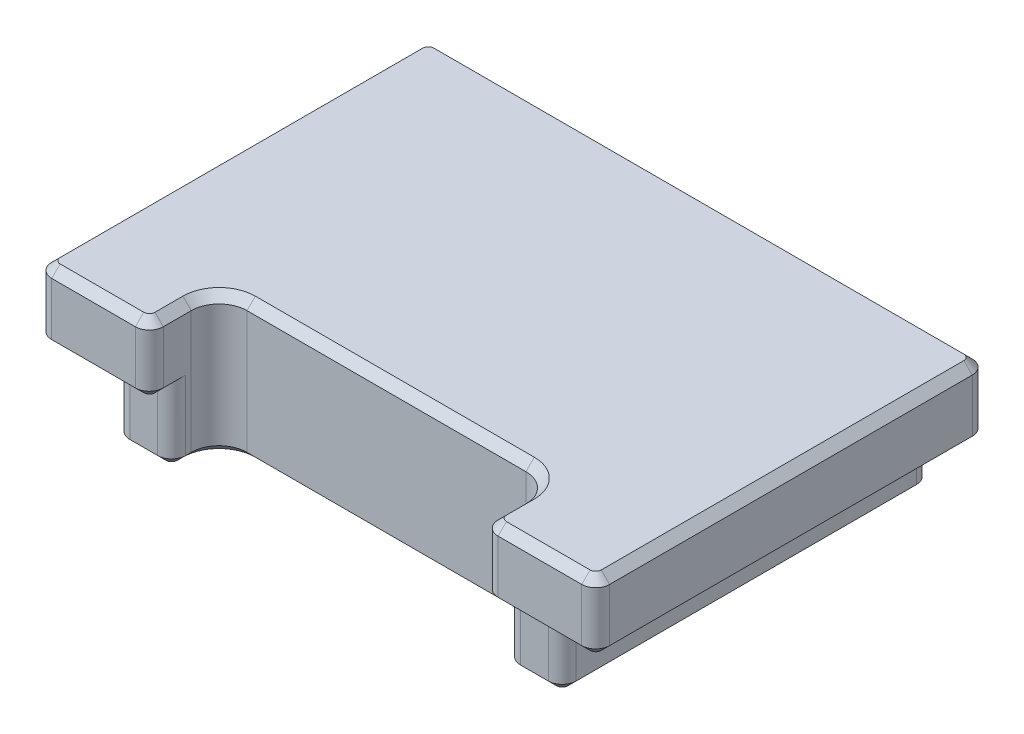
from build123d import *

# Parameters (mm, degrees)
SKETCH1_W           = 40
SKETCH1_H           = 28
BOSS_EXTRUDE1_DEPTH = 10
SKETCH2_W           = 40
SKETCH2_H           = 1.6
CUT_EXTRUDE1_DEPTH  = 5
SKETCH3_W           = 24
SKETCH3_H           = 10
CUT_EXTRUDE2_DEPTH  = 27.381811917
SKETCH4_W           = 4
SKETCH4_H           = 26.4
CUT_EXTRUDE3_DEPTH  = 5
FILLET1_R           = 2
FILLET2_R           = 1
CHAMFER2_SIZE       = 0.6


with BuildPart() as part:
    # Sketch1 → Boss-Extrude1 (new body)
    with BuildSketch(Plane(origin=(0, 0, 0), x_dir=(1, 0, 0), z_dir=(0, 1, 0))):
        Rectangle(SKETCH1_W, SKETCH1_H)
    extrude(amount=BOSS_EXTRUDE1_DEPTH)

    # Sketch2 → Cut-Extrude1 (cut)
    with BuildSketch(Plane.XZ):
        with Locations((0, 13.2)):
            Rectangle(SKETCH2_W, SKETCH2_H)
    extrude(amount=-CUT_EXTRUDE1_DEPTH, mode=Mode.SUBTRACT)

    # Sketch3 → Cut-Extrude2 (cut, through all)
    with BuildSketch(Plane(origin=(0, 10, 0), x_dir=(1, 0, 0), z_dir=(0, 1, 0))):
        with Locations((0, -14)):
            Rectangle(SKETCH3_W, SKETCH3_H)
    extrude(amount=-CUT_EXTRUDE2_DEPTH, mode=Mode.SUBTRACT)

    # Sketch4 → Cut-Extrude3 (cut)
    with BuildSketch(Plane.XZ):
        with Locations((-18, -0.8)):
            Rectangle(SKETCH4_W, SKETCH4_H)
        with Locations((18, -0.8)):
            Rectangle(SKETCH4_W, SKETCH4_H)
    extrude(amount=-CUT_EXTRUDE3_DEPTH, mode=Mode.SUBTRACT)

    # Fillet1
    fillet1_edges = [part.edges().sort_by_distance(p)[0] for p in [
        (12, 5, 9),
        (-12, 5, 9),
    ]]
    fillet(fillet1_edges, radius=FILLET1_R)

    # Fillet2
    fillet2_edges = [part.edges().sort_by_distance(p)[0] for p in [
        (12, 7.5, 14),
        (12, 2.5, 12.4),
        (-12, 7.5, 14),
        (-12, 2.5, 12.4),
        (-16, 2.5, 12.4),
        (-16, 2.5, -14),
        (16, 2.5, -14),
        (16, 2.5, 12.4),
        (20, 7.5, 14),
        (-20, 7.5, 14),
        (-20, 7.5, -14),
        (20, 7.5, -14),
    ]]
    fillet(fillet2_edges, radius=FILLET2_R)

    # Chamfer2
    chamfer2_edges = [part.edges().sort_by_distance(p)[0] for p in [
        (0, 0, -14),
        (0, 10, -14),
        (17, 5, -14),
        (-12, 10, 12),
        (12, 10, 12),
        (16, 10, 14),
        (20, 10, 0),
        (-16, 10, 14),
        (-12.292893219, 10, 13.707106781),
        (-19.707106781, 10, 13.707106781),
        (12.292893219, 10, 13.707106781),
        (19.707106781, 10, 13.707106781),
        (19.707106781, 10, -13.707106781),
        (-19.707106781, 10, -13.707106781),
        (-16, 0, -0.8),
        (16, 0, -0.8),
        (14, 0, 12.4),
        (12, 0, 11.2),
        (-12, 0, 11.2),
        (-14, 0, 12.4),
        (-12.292893219, 0, 12.107106781),
        (-15.707106781, 0, 12.107106781),
        (12.292893219, 0, 12.107106781),
        (15.707106781, 0, 12.107106781),
        (15.707106781, 0, -13.707106781),
        (-15.707106781, 0, -13.707106781),
        (20, 5, 0),
        (16, 5, 14),
        (12.292893219, 5, 13.707106781),
        (19.707106781, 5, 13.707106781),
        (19.707106781, 5, -13.707106781),
        (12, 5, 12.2),
        (-12, 5, 12.2),
        (-17, 5, -14),
        (0, 10, 9),
        (0, 0, 9),
        (11.414213562, 10, 9.585786438),
        (11.414213562, 0, 9.585786438),
        (-11.414213562, 10, 9.585786438),
        (-11.414213562, 0, 9.585786438),
        (-20, 5, 0),
        (-20, 10, 0),
        (-16, 5, 14),
        (-12.292893219, 5, 13.707106781),
        (-19.707106781, 5, 13.707106781),
        (-19.707106781, 5, -13.707106781),
    ]]
    chamfer(chamfer2_edges, length=CHAMFER2_SIZE)


solid = part.part
